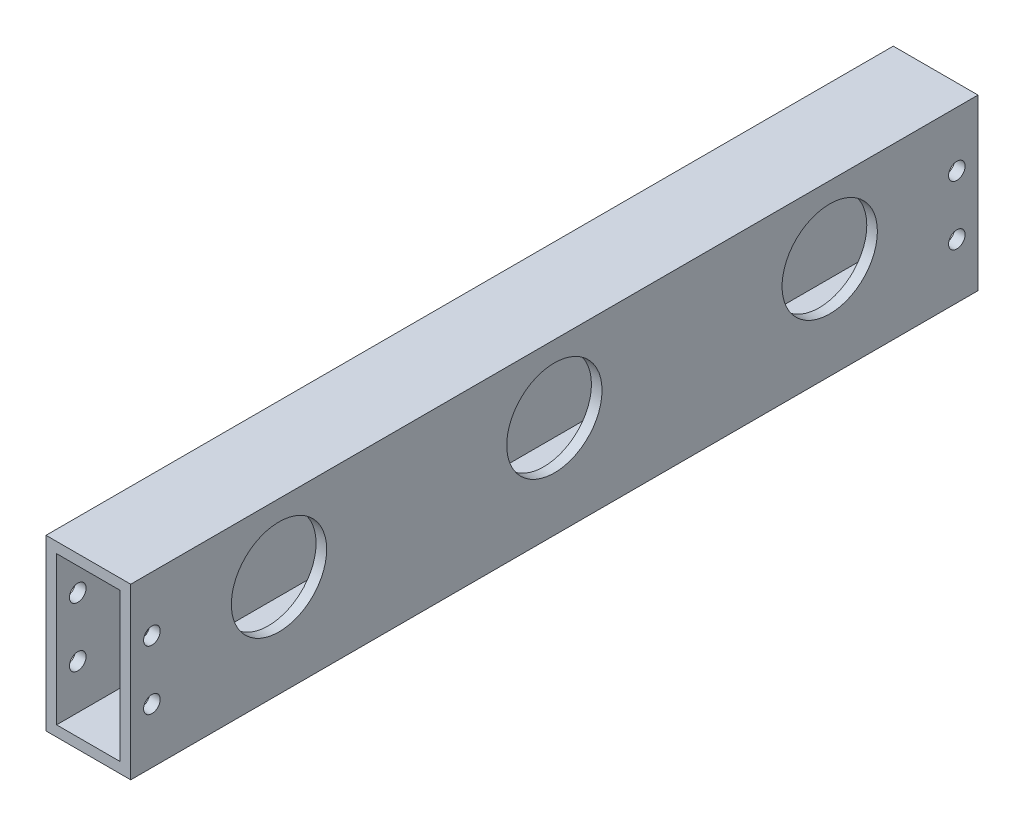
from build123d import *

# Parameters (mm, degrees)
SKETCH1_W              = 254
SKETCH1_H              = 50.8
BOSS_EXTRUDE1_DEPTH    = 25.4
SHELL1_T               = -3.175
SKETCH2_R              = 14.2875
CUT_EXTRUDE1_DEPTH     = 132.982271537
F_10_CLEARANCE_HOLE1_D = 4.9784


with BuildPart() as part:
    # Sketch1 → Boss-Extrude1 (new body)
    with BuildSketch(Plane(origin=(0, 0, 0), x_dir=(0, 0, -1), z_dir=(1, 0, 0))):
        Rectangle(SKETCH1_W, SKETCH1_H)
    extrude(amount=BOSS_EXTRUDE1_DEPTH)

    # Shell1
    shell1_openings = [part.faces().sort_by_distance(p)[0] for p in [
        (12.7, 0, 127),
        (12.7, 0, -127),
    ]]
    offset(amount=SHELL1_T, openings=shell1_openings, kind=Kind.INTERSECTION)

    # Sketch2 → Cut-Extrude1 (cut, through all)
    with BuildSketch(Plane(origin=(25.4, 0, 0), x_dir=(0, 0, -1), z_dir=(1, 0, 0))):
        with Locations((0, 5.08)):
            Circle(SKETCH2_R)
        with Locations((-82.55, 5.08)):
            Circle(SKETCH2_R)
        with Locations((82.55, 5.08)):
            Circle(SKETCH2_R)
    extrude(amount=-CUT_EXTRUDE1_DEPTH, mode=Mode.SUBTRACT)

    # #10 Clearance Hole1 (through all)
    with Locations(Plane(origin=(25.4, 0, 0), x_dir=(0, 0, -1), z_dir=(1, 0, 0))):
        with Locations((-120.65, 8.89), (-120.65, -8.89)):
            f_10_clearance_hole1 = Hole(F_10_CLEARANCE_HOLE1_D / 2)

    # Mirror1: #10 Clearance Hole1 across plane
    add(f_10_clearance_hole1.mirror(Plane.XY), mode=Mode.SUBTRACT)


solid = part.part
